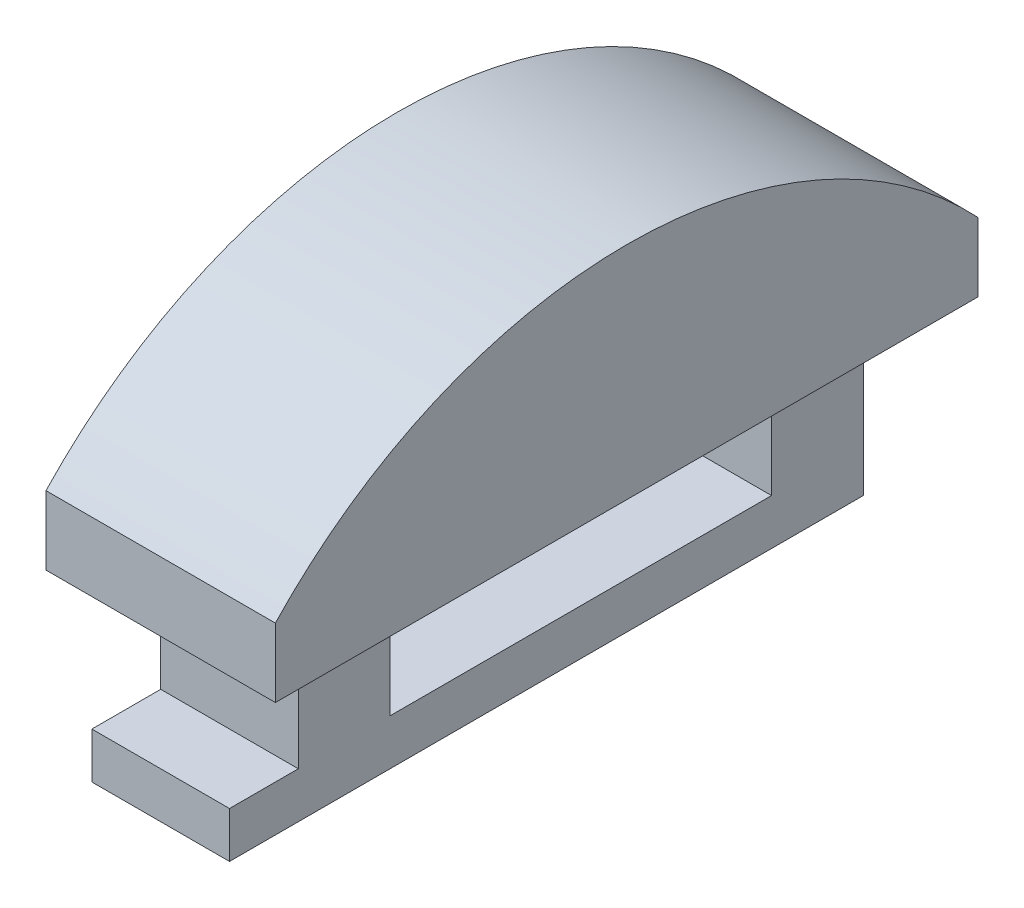
from build123d import *

# Parameters (mm, degrees)
SKETCH_1_W      = 10
SKETCH_1_H      = 30.63
EXTRUDE_1_DEPTH = 3
EXTRUDE_2_DEPTH = 10
SKETCH_3_W      = 6
SKETCH_3_H      = 4
EXTRUDE_3_DEPTH = 5
SKETCH_4_W      = 6
SKETCH_4_H      = 27.63
SKETCH_4_R      = 1.5
EXTRUDE_4_DEPTH = 2


with BuildPart() as part:
    # Эскиз1 → Бобышка-Вытянуть1 (new body)
    with BuildSketch(Plane(origin=(0, 0, 0), x_dir=(1, 0, 0), z_dir=(0, 1, 0))):
        with Locations((-87.571813581, -1.602363593)):
            Rectangle(SKETCH_1_W, SKETCH_1_H)
    extrude(amount=EXTRUDE_1_DEPTH)

    # Эскиз2 → Бобышка-Вытянуть2 (add)
    with BuildSketch(Plane(origin=(-82.571813581, 0, 0), x_dir=(0, 0, -1), z_dir=(1, 0, 0))):
        with BuildLine():
            Line((-16.917363593, 3), (13.712636407, 3))
            ThreePointArc((13.712636407, 3), (-1.602363593, 9.631604996), (-16.917363593, 3))
        make_face()
    extrude(amount=-EXTRUDE_2_DEPTH)

    # Эскиз3 → Бобышка-Вытянуть3 (add)
    with BuildSketch(Plane.XZ):
        with Locations((-87.571813581, -8.712636407)):
            Rectangle(SKETCH_3_W, SKETCH_3_H)
        Polygon((-90.562968792, 9.917363593), (-90.571813581, 13.917363593), (-84.571813581, 13.917363593), (-84.571813581, 9.917363593), align=None)
    extrude(amount=EXTRUDE_3_DEPTH)

    # Эскиз4 → Бобышка-Вытянуть4 (add)
    with BuildSketch(Plane.XZ.offset(5)):
        with Locations((-87.571813581, 3.102363593)):
            Rectangle(SKETCH_4_W, SKETCH_4_H)
        with Locations(Location((-87.571813581, 11.917363593, 0), (0, 0, 270))):
            Circle(SKETCH_4_R, mode=Mode.SUBTRACT)
        with Locations(Location((-87.571813581, -8.712636407, 0), (0, 0, 270))):
            Circle(SKETCH_4_R, mode=Mode.SUBTRACT)
    extrude(amount=EXTRUDE_4_DEPTH)


solid = part.part
